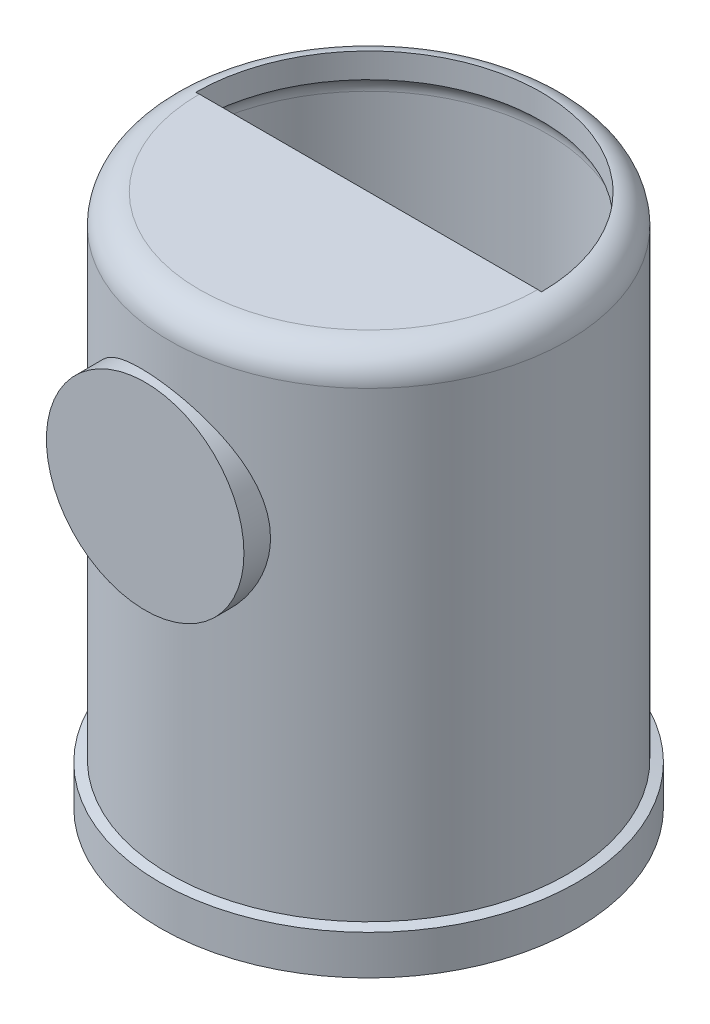
from build123d import *

# Parameters (mm, degrees)
SKETCH4_R           = 10
BOSS_EXTRUDE2_DEPTH = 6
CUT_EXTRUDE2_DEPTH  = 40


with BuildPart() as part:
    # Sketch1 → Revolve1 (revolve)
    with BuildSketch(Plane.XY):
        with BuildLine():
            Line((20.9, 0), (23.871591838, 0))
            Line((23.871591838, 0), (23.871591838, 4))
            Line((23.871591838, 4), (22.9, 4.236662843))
            Line((22.9, 4.236662843), (22.9, 51))
            ThreePointArc((22.9, 51), (22.021320344, 53.121320344), (19.9, 54))
            Line((19.9, 54), (2.764914955, 54))
            Line((2.764914955, 54), (2.764914955, 52))
            Line((2.764914955, 52), (18.9, 52))
            ThreePointArc((18.9, 52), (20.314213562, 51.414213562), (20.9, 50))
            Line((20.9, 50), (20.9, 17))
            Line((20.9, 17), (2.764914955, 17))
            Line((2.764914955, 17), (2.764914955, 15))
            Line((2.764914955, 15), (20.9, 15))
            Line((20.9, 15), (20.9, 0))
        make_face()
    revolve(axis=Axis((2.764914955, 7.821821657, 0), (0, 1, 0)))

    # Sketch4 → Boss-Extrude2 (add)
    with BuildSketch(Plane.XY.offset(21)):
        with Locations((1.144629865, 37)):
            Circle(SKETCH4_R)
    extrude(amount=-BOSS_EXTRUDE2_DEPTH)

    # Sketch9 → Cut-Extrude2 (cut)
    with BuildSketch(Plane(origin=(0, 54, 0), x_dir=(1, 0, 0), z_dir=(0, 1, 0))):
        with BuildLine():
            Line((-14.735084994, -0.001327718), (20.264915006, -0.001327718))
            ThreePointArc((20.264915006, -0.001327718), (2.764915006, 17.498672282), (-14.735084994, -0.001327718))
        make_face()
    extrude(amount=-CUT_EXTRUDE2_DEPTH, mode=Mode.SUBTRACT)


solid = part.part
